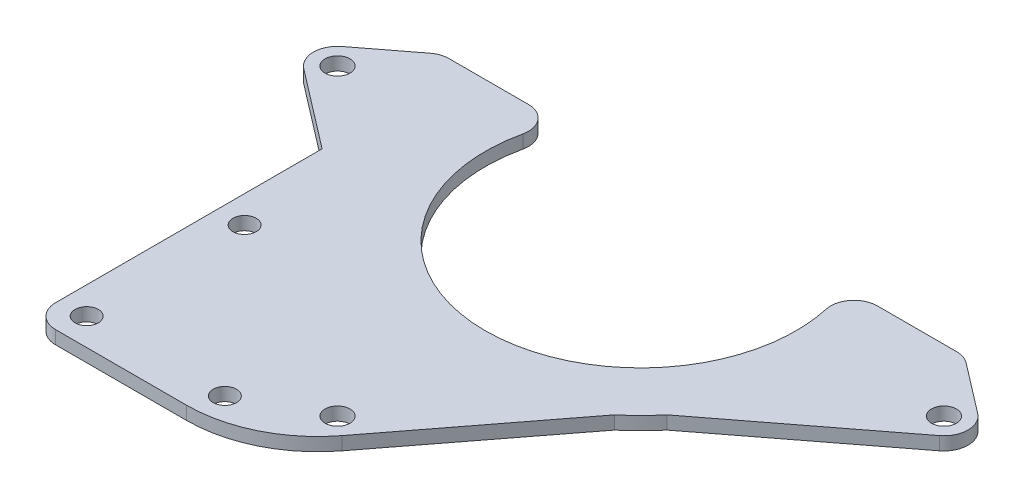
from build123d import *

# Parameters (mm, degrees)
SKETCH1_R           = 1.6
SKETCH1_R_2         = 20
BOSS_EXTRUDE2_DEPTH = 1.7
BOSS_EXTRUDE3_START = -1.7
SKETCH2_R           = 1.5
BOSS_EXTRUDE3_DEPTH = 1.7
SKETCH3_W           = 67.365157796
SKETCH3_H           = 36
CUT_EXTRUDE1_DEPTH  = 1.7
FILLET1_R           = 3


with BuildPart() as part:
    # Sketch1 → Boss-Extrude2 (new body)
    with BuildSketch(Plane(origin=(0, 0, 0), x_dir=(1, 0, 0), z_dir=(0, 1, 0))):
        with BuildLine():
            Line((-17.673720383, -21.068687852), (-2.459890554, -40.906514899))
            ThreePointArc((-2.459890554, -40.906514899), (0, -42.12), (2.459890554, -40.906514899))
            Line((2.459890554, -40.906514899), (17.673720383, -21.068687852))
            ThreePointArc((17.673720383, -21.068687852), (19.445436483, -19.445436483), (21.068687852, -17.673720383))
            Line((21.068687852, -17.673720383), (40.906514899, -2.459890554))
            ThreePointArc((40.906514899, -2.459890554), (42.12, 0), (40.906514899, 2.459890554))
            Line((40.906514899, 2.459890554), (21.068687852, 17.673720383))
            ThreePointArc((21.068687852, 17.673720383), (19.445436483, 19.445436483), (17.673720383, 21.068687852))
            Line((17.673720383, 21.068687852), (2.459890554, 40.906514899))
            ThreePointArc((2.459890554, 40.906514899), (0, 42.12), (-2.459890554, 40.906514899))
            Line((-2.459890554, 40.906514899), (-17.673720383, 21.068687852))
            ThreePointArc((-17.673720383, 21.068687852), (-19.445436483, 19.445436483), (-21.068687852, 17.673720383))
            Line((-21.068687852, 17.673720383), (-40.906514899, 2.459890554))
            ThreePointArc((-40.906514899, 2.459890554), (-42.12, 0), (-40.906514899, -2.459890554))
            Line((-40.906514899, -2.459890554), (-21.068687852, -17.673720383))
            ThreePointArc((-21.068687852, -17.673720383), (-19.445436483, -19.445436483), (-17.673720383, -21.068687852))
        make_face()
        with Locations(Location((0, -39.02, 0), (0, 0, 270))):
            Circle(SKETCH1_R, mode=Mode.SUBTRACT)
        with Locations(Location((0, 0, 0), (0, 0, 270))):
            Circle(SKETCH1_R_2, mode=Mode.SUBTRACT)
        with Locations(Location((-39.02, 0, 0), (0, 0, 270))):
            Circle(SKETCH1_R, mode=Mode.SUBTRACT)
        with Locations(Location((39.02, 0, 0), (0, 0, 270))):
            Circle(SKETCH1_R, mode=Mode.SUBTRACT)
        with Locations(Location((0, 39.02, 0), (0, 0, 270))):
            Circle(SKETCH1_R, mode=Mode.SUBTRACT)
    extrude(amount=BOSS_EXTRUDE2_DEPTH)

    # Sketch2 → Boss-Extrude3 (add)
    with BuildSketch(Plane(origin=(0, 1.7, 0), x_dir=(1, 0, 0), z_dir=(0, 1, 0)).offset(BOSS_EXTRUDE3_START)):
        with BuildLine():
            Line((-30.78, -47.52), (-30.78, -10.226017059))
            Line((-30.78, -10.226017059), (-21.068687852, -17.673720383))
            ThreePointArc((-21.068687852, -17.673720383), (-19.445436483, -19.445436483), (-17.673720383, -21.068687852))
            Line((-17.673720383, -21.068687852), (-2.459890554, -40.906514899))
            ThreePointArc((-2.459890554, -40.906514899), (0, -42.12), (2.459890554, -40.906514899))
            ThreePointArc((2.459890554, -40.906514899), (-3.472049402, -45.77668656), (-10.946495328, -47.52))
            Line((-10.946495328, -47.52), (-30.78, -47.52))
        make_face()
        with Locations(Location((-9.5, -44.02, 0), (0, 0, 270))):
            Circle(SKETCH2_R, mode=Mode.SUBTRACT)
        with Locations(Location((-27.28, -44.02, 0), (0, 0, 270))):
            Circle(SKETCH2_R, mode=Mode.SUBTRACT)
        with Locations(Location((-27.28, -23.7, 0), (0, 0, 270))):
            Circle(SKETCH2_R, mode=Mode.SUBTRACT)
    extrude(amount=BOSS_EXTRUDE3_DEPTH)

    # Sketch3 → Cut-Extrude1 (cut)
    with BuildSketch(Plane(origin=(0, 1.7, 0), x_dir=(1, 0, 0), z_dir=(0, 1, 0))):
        with Locations((0, 26)):
            Rectangle(SKETCH3_W, SKETCH3_H)
    extrude(amount=-CUT_EXTRUDE1_DEPTH, mode=Mode.SUBTRACT)

    # Fillet1
    fillet1_edges = [part.edges().sort_by_distance(p)[0] for p in [
        (-18.33030278, 0.85, -8),
        (18.33030278, 0.85, -8),
        (-33.682578898, 0.85, -8),
        (33.682578898, 0.85, -8),
        (-30.78, 0.85, 47.52),
    ]]
    fillet(fillet1_edges, radius=FILLET1_R)


solid = part.part
